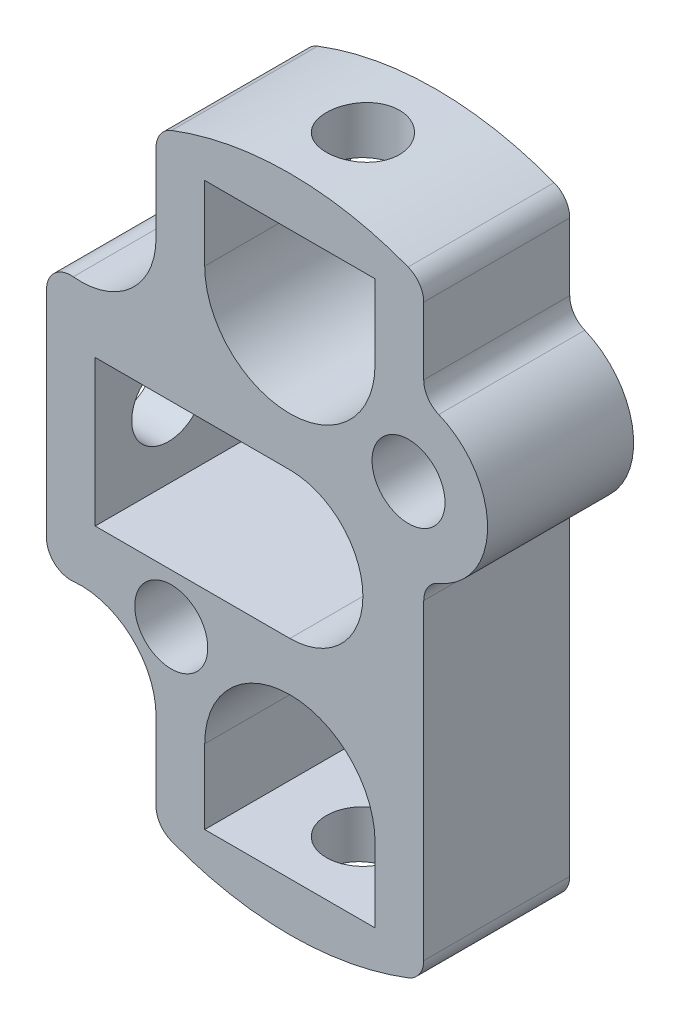
from build123d import *

# Parameters (mm, degrees)
ESQUISSE1_R             = 1.5
BOSS_EXTRU_1_DEPTH      = 6
ESQUISSE2_R             = 1.5
ENL_V_MAT_EXTRU_1_DEPTH = 28.676885663
ESQUISSE3_R             = 1.5
ENL_V_MAT_EXTRU_2_DEPTH = 22.90010149


with BuildPart() as part:
    # Esquisse1 → Boss.-Extru.1 (new body)
    with BuildSketch(Plane.XY):
        with BuildLine():
            Line((-10, 4.424421769), (-10, -4.424421769))
            ThreePointArc((-10, -4.424421769), (-9.671289073, -5.165617412), (-8.901258038, -5.41953484))
            ThreePointArc((-8.901258038, -5.41953484), (-6.517555279, -6.205559881), (-5.5, -8.5))
            Line((-5.5, -8.5), (-5.5, -11.715481211))
            ThreePointArc((-5.5, -11.715481211), (-5.324186186, -12.281800142), (-4.858565737, -12.64898569))
            ThreePointArc((-4.858565737, -12.64898569), (0, -13.55), (4.858565737, -12.64898569))
            ThreePointArc((4.858565737, -12.64898569), (5.324186186, -12.281800142), (5.5, -11.715481211))
            Line((5.5, -11.715481211), (5.5, 1.096471453))
            ThreePointArc((5.5, 1.096471453), (5.66862168, 1.65217829), (6.117620177, 2.020476687))
            ThreePointArc((6.117620177, 2.020476687), (8.124885753, 5.023493695), (6.117620177, 8.026510703))
            ThreePointArc((6.117620177, 8.026510703), (5.66862168, 8.394809099), (5.5, 8.950515936))
            Line((5.5, 8.950515936), (5.5, 11.715481211))
            ThreePointArc((5.5, 11.715481211), (5.324186186, 12.281800142), (4.858565737, 12.64898569))
            ThreePointArc((4.858565737, 12.64898569), (0, 13.55), (-4.858565737, 12.64898569))
            ThreePointArc((-4.858565737, 12.64898569), (-5.324186186, 12.281800142), (-5.5, 11.715481211))
            Line((-5.5, 11.715481211), (-5.5, 8.5))
            ThreePointArc((-5.5, 8.5), (-6.517555279, 6.205559881), (-8.901258038, 5.41953484))
            ThreePointArc((-8.901258038, 5.41953484), (-9.671289073, 5.165617412), (-10, 4.424421769))
        make_face()
        with Locations((-4.874885753, -5.023493695)):
            Circle(ESQUISSE1_R, mode=Mode.SUBTRACT)
        with Locations((4.874885753, 5.023493695)):
            Circle(ESQUISSE1_R, mode=Mode.SUBTRACT)
        with BuildLine():
            Line((-3.5, 11.55), (3.5, 11.55))
            Line((3.5, 11.55), (3.5, 8.5))
            ThreePointArc((3.5, 8.5), (0, 5), (-3.5, 8.5))
            Line((-3.5, 8.5), (-3.5, 11.55))
        make_face(mode=Mode.SUBTRACT)
        with BuildLine():
            Line((-3.5, -11.55), (3.5, -11.55))
            Line((3.5, -11.55), (3.5, -8.5))
            ThreePointArc((3.5, -8.5), (0, -5), (-3.5, -8.5))
            Line((-3.5, -8.5), (-3.5, -11.55))
        make_face(mode=Mode.SUBTRACT)
        with BuildLine():
            Line((0, -3), (-8, -3))
            Line((-8, -3), (-8, 3))
            Line((-8, 3), (0, 3))
            ThreePointArc((0, 3), (3, 0), (0, -3))
        make_face(mode=Mode.SUBTRACT)
    extrude(amount=BOSS_EXTRU_1_DEPTH)

    # Esquisse2 → Enlèv. mat.-Extru.1 (cut, through all)
    with BuildSketch(Plane.XZ.offset(-11.55)):
        with Locations(Location((0, 3, 0), (0, 0, 270))):
            Circle(ESQUISSE2_R)
    enl_v_mat_extru_1 = extrude(amount=-ENL_V_MAT_EXTRU_1_DEPTH, mode=Mode.SUBTRACT)

    # Symétrie1: Enlèv. mat.-Extru.1 across plane
    add(enl_v_mat_extru_1.mirror(Plane.ZX), mode=Mode.SUBTRACT)

    # Esquisse3 → Enlèv. mat.-Extru.2 (cut, through all)
    with BuildSketch(Plane(origin=(-8, 0, 0), x_dir=(0, 0, -1), z_dir=(1, 0, 0))):
        with Locations((-3, 0)):
            Circle(ESQUISSE3_R)
    extrude(amount=-ENL_V_MAT_EXTRU_2_DEPTH, mode=Mode.SUBTRACT)


solid = part.part
